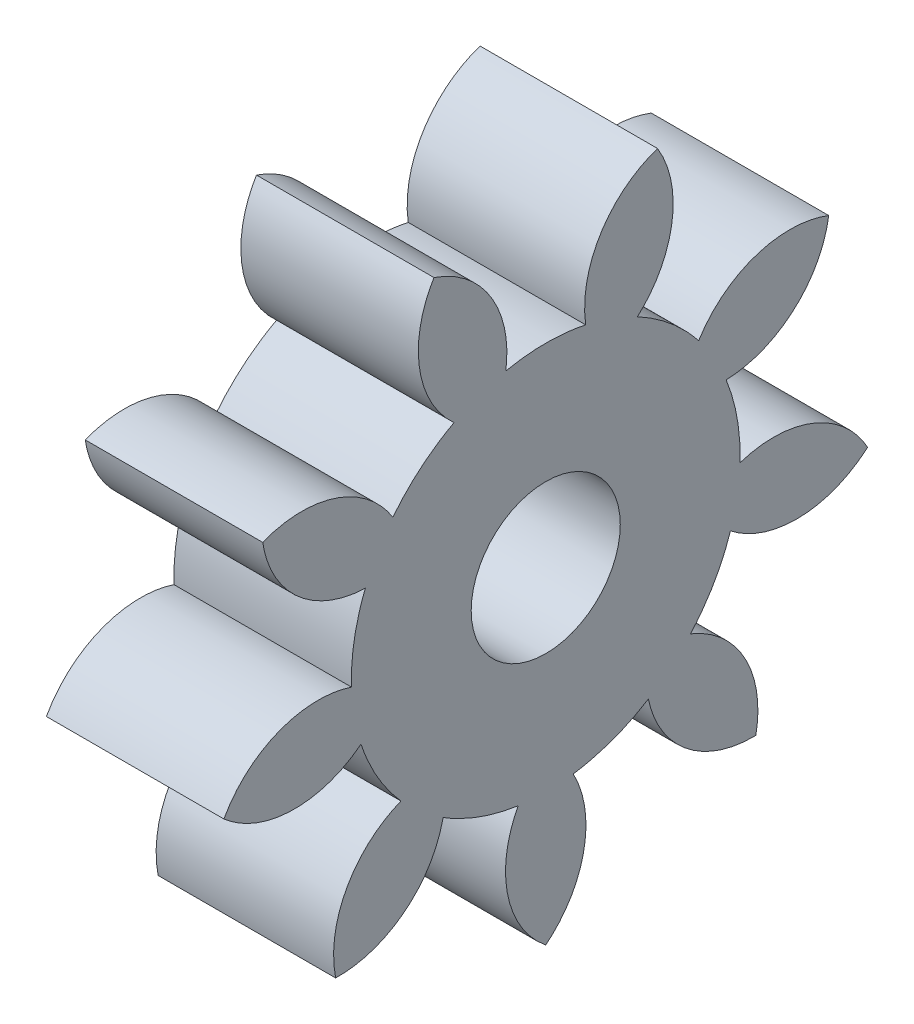
from build123d import *

# Parameters (mm, degrees)
BASPROSKE_W     = 3.175
BASPROSKE_H     = 6.985
TOOTHCUT_DEPTH  = 11.375985495
TEETHCUTS_COUNT = 9
BORSKE_R        = 1.5875
BORE_DEPTH      = 50.8000508
SCALE1_SCALE_X  = 1
SCALE1_SCALE_Y  = 0.84
SCALE1_SCALE_Z  = 0.84


with BuildPart() as part:
    # BasProSke → Base-Revolve (revolve)
    with BuildSketch(Plane(origin=(0, 0, 0), x_dir=(1, 0, 0), z_dir=(0, 1, 0)), mode=Mode.PRIVATE) as base_revolve_sk:
        with Locations((1.5875, 3.4925)):
            Rectangle(BASPROSKE_W, BASPROSKE_H)
    revolve(base_revolve_sk.sketch.rotate(Axis((-10, 0, 0), (1, 0, 0)), 180), axis=Axis((-10, 0, 0), (1, 0, 0)))

    # TooCutSke → ToothCut (cut, through all)
    with BuildSketch(Plane(origin=(0, 0, 0), x_dir=(0, 0, -1), z_dir=(1, 0, 0))):
        with BuildLine():
            ThreePointArc((0.85090004, 4.051817513), (0, 4.1402), (-0.85090004, 4.051817513))
            ThreePointArc((-0.85090004, 4.051817513), (-1.187930048, 5.606894235), (-2.458065659, 6.565334826))
            ThreePointArc((-2.458065659, 6.565334826), (0, 7.0104), (2.458065659, 6.565334826))
            ThreePointArc((2.458065659, 6.565334826), (1.187930048, 5.606894235), (0.85090004, 4.051817513))
        make_face()
    toothcut = extrude(amount=TOOTHCUT_DEPTH, mode=Mode.SUBTRACT)

    # TeethCuts: ToothCut ×9 about axis
    teethcuts_axis = Axis((-10, 0, 0), (1, 0, 0))
    for i in range(1, TEETHCUTS_COUNT):
        add(toothcut.rotate(teethcuts_axis, i * 360 / TEETHCUTS_COUNT), mode=Mode.SUBTRACT)

    # BorSke → Bore (cut, symmetric)
    with BuildSketch(Plane(origin=(0, 0, 0), x_dir=(0, 0, -1), z_dir=(1, 0, 0))):
        with Locations(Location((0, 0, 0), (0, 0, 180))):
            Circle(BORSKE_R)
    extrude(amount=BORE_DEPTH, both=True, mode=Mode.SUBTRACT)


with BuildPart() as part_1:
    # Scale1: scaled about (1.5875, 0, 0)
    add(part.part.scale((SCALE1_SCALE_X, SCALE1_SCALE_Y, SCALE1_SCALE_Z), about=(1.5875, 0, 0)))


solid = part_1.part
